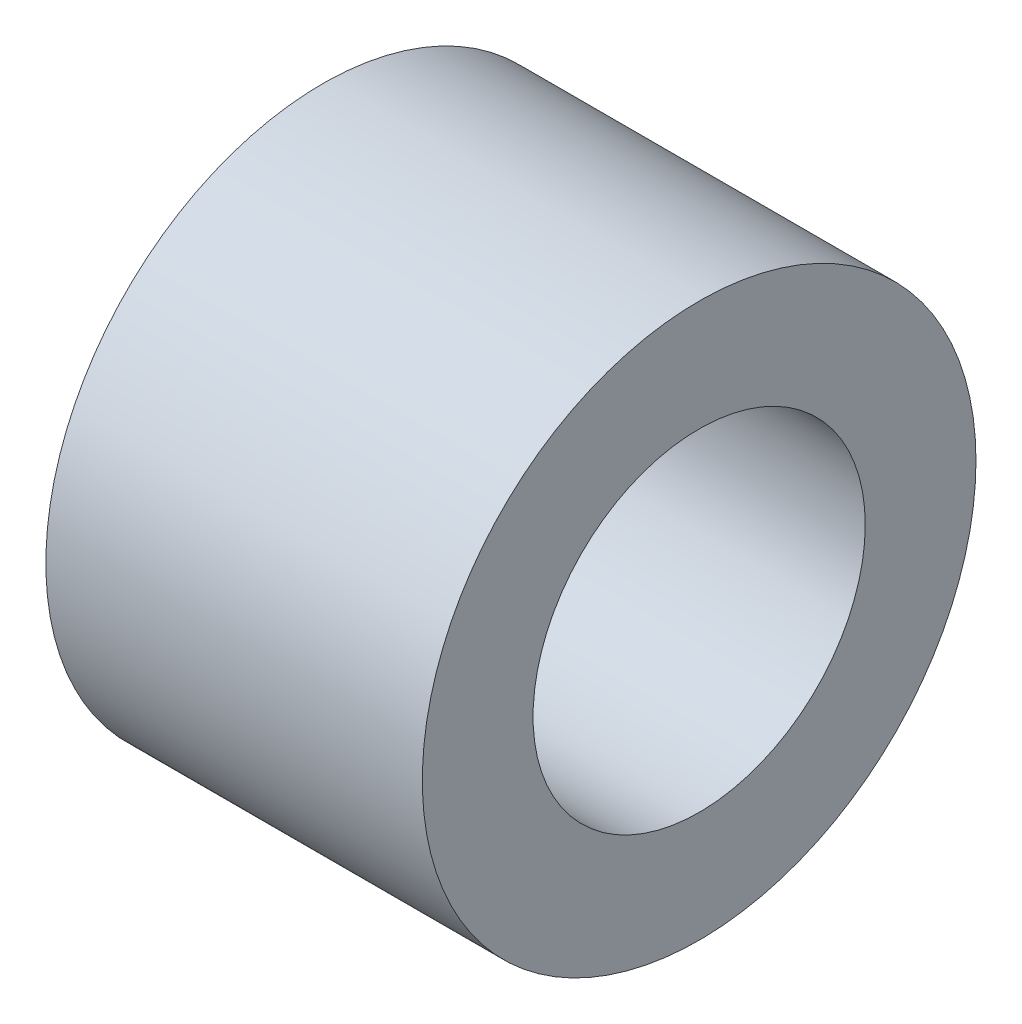
from build123d import *

# Parameters (mm, degrees)
SKETCH1_R           = 2.5
SKETCH1_R_2         = 1.5
BOSS_EXTRUDE1_DEPTH = 3.4


with BuildPart() as part:
    # Sketch1 → Boss-Extrude1 (new body)
    with BuildSketch(Plane(origin=(0, 0, 0), x_dir=(0, 0, -1), z_dir=(1, 0, 0))):
        Circle(SKETCH1_R)
        Circle(SKETCH1_R_2, mode=Mode.SUBTRACT)
    extrude(amount=BOSS_EXTRUDE1_DEPTH)


solid = part.part
